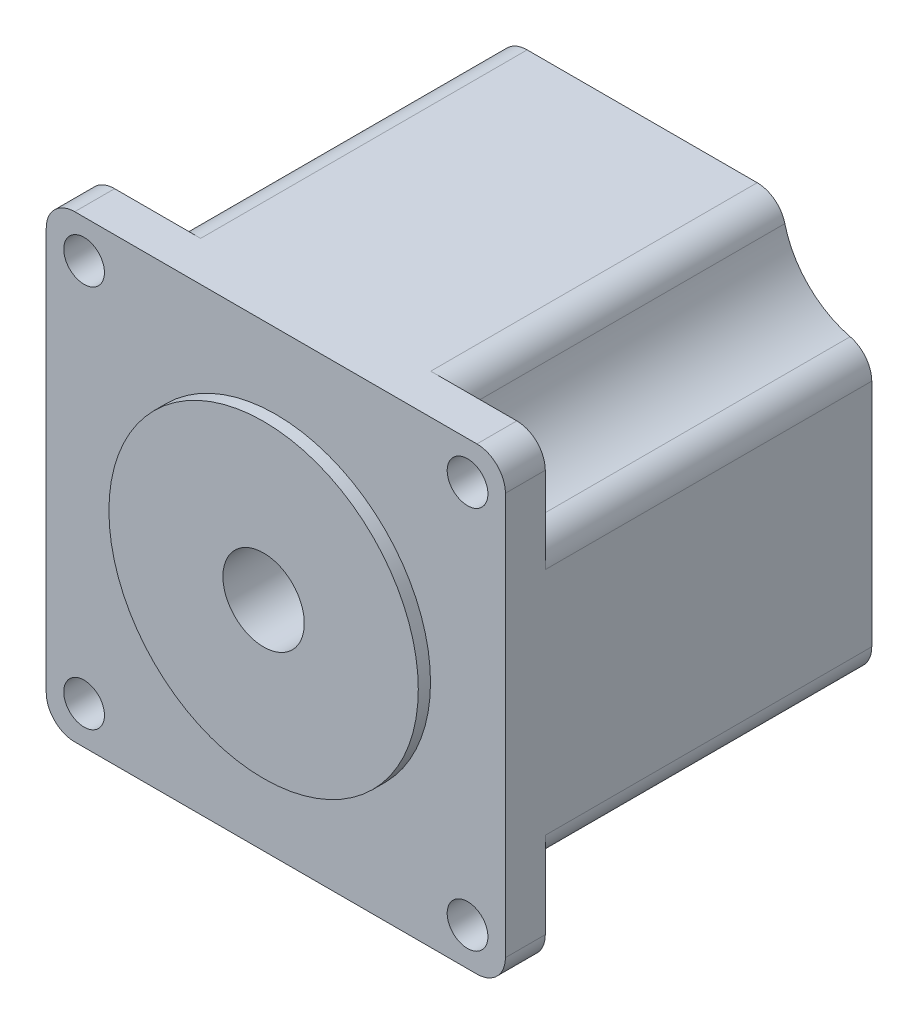
from build123d import *

# Parameters (mm, degrees)
SKETCH1_R           = 5
BOSS_EXTRUDE1_DEPTH = 45
SKETCH2_R           = 19
SKETCH2_R_2         = 5
BOSS_EXTRUDE2_DEPTH = 1.5
SKETCH3_R           = 2.5
CUT_EXTRUDE1_DEPTH  = 61.128861622
SKETCH4_R           = 2.5
CUT_EXTRUDE2_DEPTH  = 40.1
FILLET1_R           = 3.5


with BuildPart() as part:
    # Sketch1 → Boss-Extrude1 (new body)
    with BuildSketch(Plane.XY):
        with BuildLine():
            Line((-24.7, -28.2), (24.7, -28.2))
            ThreePointArc((24.7, -28.2), (27.174873734, -27.174873734), (28.2, -24.7))
            Line((28.2, -24.7), (28.2, 24.7))
            ThreePointArc((28.2, 24.7), (27.174873734, 27.174873734), (24.7, 28.2))
            Line((24.7, 28.2), (-24.7, 28.2))
            ThreePointArc((-24.7, 28.2), (-27.174873734, 27.174873734), (-28.2, 24.7))
            Line((-28.2, 24.7), (-28.2, -24.7))
            ThreePointArc((-28.2, -24.7), (-27.174873734, -27.174873734), (-24.7, -28.2))
        make_face()
        with Locations(Location((0, 0, 0), (0, 0, 180))):
            Circle(SKETCH1_R, mode=Mode.SUBTRACT)
    extrude(amount=BOSS_EXTRUDE1_DEPTH)

    # Sketch2 → Boss-Extrude2 (add)
    with BuildSketch(Plane.XY.offset(45)):
        Circle(SKETCH2_R)
        with Locations(Location((0, 0, 0), (0, 0, 180))):
            Circle(SKETCH2_R_2, mode=Mode.SUBTRACT)
    extrude(amount=BOSS_EXTRUDE2_DEPTH)

    # Sketch3 → Cut-Extrude1 (cut, through all)
    with BuildSketch(Plane.XY.offset(45)):
        with Locations((-23.55, 23.55)):
            Circle(SKETCH3_R)
        with Locations((23.55, 23.55)):
            Circle(SKETCH3_R)
        with Locations((23.55, -23.55)):
            Circle(SKETCH3_R)
        with Locations((-23.55, -23.55)):
            Circle(SKETCH3_R)
    extrude(amount=-CUT_EXTRUDE1_DEPTH, mode=Mode.SUBTRACT)

    # Sketch4 → Cut-Extrude2 (cut)
    # profile 1 of 4: a face of its own
    with BuildSketch(Plane(origin=(0, 0, 0), x_dir=(-1, 0, 0), z_dir=(0, 0, -1))):
        with BuildLine():
            ThreePointArc((-28.2, 17.2), (-20.421825407, 20.421825407), (-17.2, 28.2))
            Line((-17.2, 28.2), (-24.7, 28.2))
            ThreePointArc((-24.7, 28.2), (-27.174873734, 27.174873734), (-28.2, 24.7))
            Line((-28.2, 24.7), (-28.2, 17.2))
        make_face()
        with Locations(Location((-23.55, 23.55, 0), (0, 0, 180))):
            Circle(SKETCH4_R, mode=Mode.SUBTRACT)
    # profile 2 of 4: a face of its own
    with BuildSketch(Plane(origin=(0, 0, 0), x_dir=(-1, 0, 0), z_dir=(0, 0, -1))):
        with BuildLine():
            Line((-24.7, -28.2), (-17.2, -28.2))
            ThreePointArc((-17.2, -28.2), (-20.421825407, -20.421825407), (-28.2, -17.2))
            Line((-28.2, -17.2), (-28.2, -24.7))
            ThreePointArc((-28.2, -24.7), (-27.174873734, -27.174873734), (-24.7, -28.2))
        make_face()
        with Locations(Location((-23.55, -23.55, 0), (0, 0, 180))):
            Circle(SKETCH4_R, mode=Mode.SUBTRACT)
    # profile 3 of 4: a face of its own
    with BuildSketch(Plane(origin=(0, 0, 0), x_dir=(-1, 0, 0), z_dir=(0, 0, -1))):
        with BuildLine():
            Line((28.2, -24.7), (28.2, -17.2))
            ThreePointArc((28.2, -17.2), (20.421825407, -20.421825407), (17.2, -28.2))
            Line((17.2, -28.2), (24.7, -28.2))
            ThreePointArc((24.7, -28.2), (27.174873734, -27.174873734), (28.2, -24.7))
        make_face()
        with Locations(Location((23.55, -23.55, 0), (0, 0, 180))):
            Circle(SKETCH4_R, mode=Mode.SUBTRACT)
    # profile 4 of 4: a face of its own
    with BuildSketch(Plane(origin=(0, 0, 0), x_dir=(-1, 0, 0), z_dir=(0, 0, -1))):
        with BuildLine():
            ThreePointArc((17.2, 28.2), (20.421825407, 20.421825407), (28.2, 17.2))
            Line((28.2, 17.2), (28.2, 24.7))
            ThreePointArc((28.2, 24.7), (27.174873734, 27.174873734), (24.7, 28.2))
            Line((24.7, 28.2), (17.2, 28.2))
        make_face()
        with Locations(Location((23.55, 23.55, 0), (0, 0, 180))):
            Circle(SKETCH4_R, mode=Mode.SUBTRACT)
    extrude(amount=-CUT_EXTRUDE2_DEPTH, mode=Mode.SUBTRACT)

    # Fillet1
    fillet1_edges = [part.edges().sort_by_distance(p)[0] for p in [
        (-17.2, 28.2, 20.05),
        (-28.2, 17.2, 20.05),
        (-17.2, -28.2, 20.05),
        (-28.2, -17.2, 20.05),
        (28.2, -17.2, 20.05),
        (17.2, -28.2, 20.05),
        (28.2, 17.2, 20.05),
        (17.2, 28.2, 20.05),
    ]]
    fillet(fillet1_edges, radius=FILLET1_R)


solid = part.part
